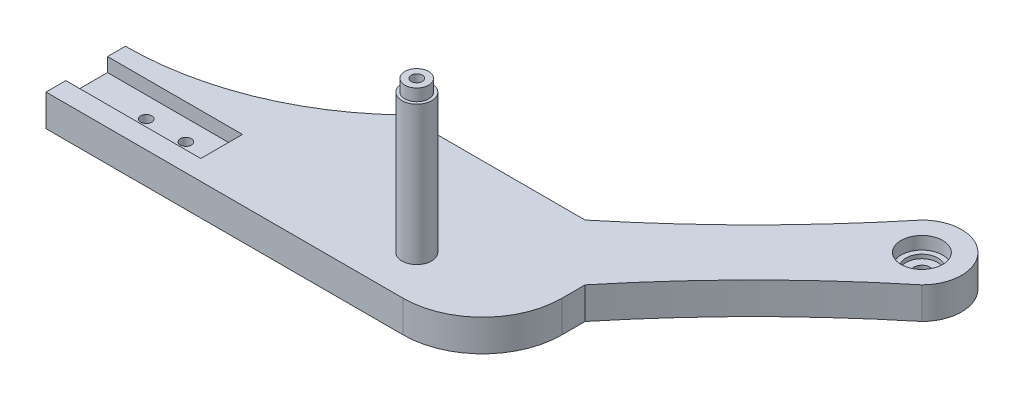
from build123d import *

# Parameters (mm, degrees)
BOSS_EXTRUDE1_DEPTH      = 8
CUT_EXTRUDE1_DEPTH       = 121.027140353
CUT_EXTRUDE1_DEPTH_BACK  = 121.027140353
SKETCH2_R                = 1.4
CUT_EXTRUDE2_DEPTH       = 121.027140353
SKETCH4_R                = 5.25
CUT_EXTRUDE3_DEPTH       = 3.2
SKETCH5_R                = 4
CUT_EXTRUDE4_DEPTH       = 1
SKETCH6_R                = 5
CUT_EXTRUDE5_DEPTH       = 2
CUT_EXTRUDE6_DEPTH       = 120.833861747
CUT_EXTRUDE6_DEPTH_BACK  = 120.833861747
SKETCH7_R                = 2
SKETCH9_R                = 3.75
BOSS_EXTRUDE2_DEPTH      = 35
SKETCH10_R               = 3
BOSS_EXTRUDE3_DEPTH      = 3
CUT_EXTRUDE8_DEPTH       = 129.29074176
CUT_EXTRUDE8_DEPTH_BACK  = 129.29074176
SKETCH11_R               = 1.4
CUT_EXTRUDE9_DEPTH       = 126.644396697
CUT_EXTRUDE9_DEPTH_BACK  = 126.644396697
SKETCH13_W               = 34
SKETCH13_H               = 10.5
CUT_EXTRUDE10_DEPTH      = 3.5
FILLET2_R                = 20
CUT_EXTRUDE11_DEPTH      = 127.746851721
CUT_EXTRUDE11_DEPTH_BACK = 127.746851721
SKETCH14_R               = 1.4


with BuildPart() as part:
    # Sketch1 → Boss-Extrude1 (new body)
    with BuildSketch(Plane(origin=(0, 0, 0), x_dir=(1, 0, 0), z_dir=(0, 1, 0))):
        with BuildLine():
            Line((40.857864376, 20), (83.284271247, 62.426406871))
            ThreePointArc((83.284271247, 62.426406871), (97.426406871, 62.426406871), (97.426406871, 48.284271247))
            Line((97.426406871, 48.284271247), (55, 5.857864376))
            Line((55, 5.857864376), (55, -20))
            Line((55, -20), (-55, -20))
            Line((-55, -20), (-55, 20))
            Line((-55, 20), (40.857864376, 20))
        make_face()
    extrude(amount=BOSS_EXTRUDE1_DEPTH)

    # Sketch2 → Cut-Extrude1 (cut, two sides: drawn at the far end of the back side and taken through both)
    with BuildSketch(Plane(origin=(0, 8, 0), x_dir=(1, 0, 0), z_dir=(0, 1, 0)).offset(-CUT_EXTRUDE1_DEPTH_BACK)):
        with Locations((90.355339059, 55.355339059)):
            Circle(SKETCH2_R)
        with Locations((26.715728753, -8.284271247)):
            Circle(SKETCH2_R)
    extrude(amount=CUT_EXTRUDE1_DEPTH + CUT_EXTRUDE1_DEPTH_BACK, mode=Mode.SUBTRACT)

    # Sketch3 → Cut-Extrude2 (cut, symmetric)
    with BuildSketch(Plane(origin=(0, 8, 0), x_dir=(1, 0, 0), z_dir=(0, 1, 0))):
        with BuildLine():
            Line((40.857864376, 20), (83.284271247, 62.426406871))
            ThreePointArc((83.284271247, 62.426406871), (63.134392976, 40.149878272), (40.857864376, 20))
        make_face()
    cut_extrude2 = extrude(amount=CUT_EXTRUDE2_DEPTH, both=True, mode=Mode.SUBTRACT)

    # Mirror1: Cut-Extrude2 across plane
    add(cut_extrude2.mirror(Plane(origin=(17.5, 0, 17.5), x_dir=(-0.7071067811865461, 0, 0.707106781186549), z_dir=(0.7071067811865492, 0, 0.7071067811865459))), mode=Mode.SUBTRACT)

    # Sketch4 → Cut-Extrude3 (cut)
    with BuildSketch(Plane(origin=(0, 8, 0), x_dir=(1, 0, 0), z_dir=(0, 1, 0))):
        with Locations((90.355339059, 55.355339059)):
            Circle(SKETCH4_R)
    extrude(amount=-CUT_EXTRUDE3_DEPTH, mode=Mode.SUBTRACT)

    # Sketch5 → Cut-Extrude4 (cut)
    with BuildSketch(Plane(origin=(0, 4.8, 0), x_dir=(1, 0, 0), z_dir=(0, 1, 0))):
        with Locations((90.355339059, 55.355339059)):
            Circle(SKETCH5_R)
    extrude(amount=-CUT_EXTRUDE4_DEPTH, mode=Mode.SUBTRACT)

    # Sketch6 → Cut-Extrude5 (cut)
    with BuildSketch(Plane.XZ):
        with Locations((90.355339059, -55.355339059)):
            Circle(SKETCH6_R)
    extrude(amount=-CUT_EXTRUDE5_DEPTH, mode=Mode.SUBTRACT)

    # Sketch7 → Cut-Extrude6 (cut, two sides: drawn at the far end of the back side and taken through both)
    with BuildSketch(Plane(origin=(0, 3.8, 0), x_dir=(1, 0, 0), z_dir=(0, 1, 0)).offset(-CUT_EXTRUDE6_DEPTH_BACK)):
        with Locations((90.355339059, 55.355339059)):
            Circle(SKETCH7_R)
    extrude(amount=CUT_EXTRUDE6_DEPTH + CUT_EXTRUDE6_DEPTH_BACK, mode=Mode.SUBTRACT)

    # Sketch9 → Boss-Extrude2 (add)
    with BuildSketch(Plane(origin=(0, 8, 0), x_dir=(1, 0, 0), z_dir=(0, 1, 0))):
        with Locations((26.715728753, -8.284271247)):
            Circle(SKETCH9_R)
    extrude(amount=BOSS_EXTRUDE2_DEPTH)

    # Sketch10 → Boss-Extrude3 (add)
    with BuildSketch(Plane(origin=(0, 43, 0), x_dir=(1, 0, 0), z_dir=(0, 1, 0))):
        with Locations((26.715728753, -8.284271247)):
            Circle(SKETCH10_R)
    extrude(amount=BOSS_EXTRUDE3_DEPTH)

    # Sketch11 → Cut-Extrude8 (cut, two sides: drawn at the far end of the back side and taken through both)
    with BuildSketch(Plane(origin=(0, 46, 0), x_dir=(1, 0, 0), z_dir=(0, 1, 0)).offset(-CUT_EXTRUDE8_DEPTH_BACK)):
        with Locations((26.715728753, -8.284271247)):
            Circle(SKETCH11_R)
    extrude(amount=CUT_EXTRUDE8_DEPTH + CUT_EXTRUDE8_DEPTH_BACK, mode=Mode.SUBTRACT)

    # Sketch12 → Cut-Extrude9 (cut, two sides: drawn at the far end of the back side and taken through both)
    with BuildSketch(Plane(origin=(0, 8, 0), x_dir=(1, 0, 0), z_dir=(0, 1, 0)).offset(-CUT_EXTRUDE9_DEPTH_BACK)):
        with BuildLine():
            Line((-55, 0), (-55, 20))
            Line((-55, 20), (-5, 20))
            ThreePointArc((-5, 20), (-28.074175964, 5.185439911), (-55, 0))
        make_face()
    extrude(amount=CUT_EXTRUDE9_DEPTH + CUT_EXTRUDE9_DEPTH_BACK, mode=Mode.SUBTRACT)

    # Sketch13 → Cut-Extrude10 (cut)
    with BuildSketch(Plane(origin=(0, 8, 0), x_dir=(1, 0, 0), z_dir=(0, 1, 0))):
        with Locations((-38, -9.75)):
            Rectangle(SKETCH13_W, SKETCH13_H)
    extrude(amount=-CUT_EXTRUDE10_DEPTH, mode=Mode.SUBTRACT)

    # Fillet2
    fillet2_edges = [part.edges().sort_by_distance(p)[0] for p in [
        (55, 4, 20),
    ]]
    fillet(fillet2_edges, radius=FILLET2_R)

    # Sketch14 → Cut-Extrude11 (cut, two sides: drawn at the far end of the back side and taken through both)
    with BuildSketch(Plane(origin=(0, 4.5, 0), x_dir=(1, 0, 0), z_dir=(0, 1, 0)).offset(-CUT_EXTRUDE11_DEPTH_BACK)):
        with Locations((-40, -9.75)):
            Circle(SKETCH14_R)
        with Locations((-30, -9.75)):
            Circle(SKETCH14_R)
    extrude(amount=CUT_EXTRUDE11_DEPTH + CUT_EXTRUDE11_DEPTH_BACK, mode=Mode.SUBTRACT)


solid = part.part
